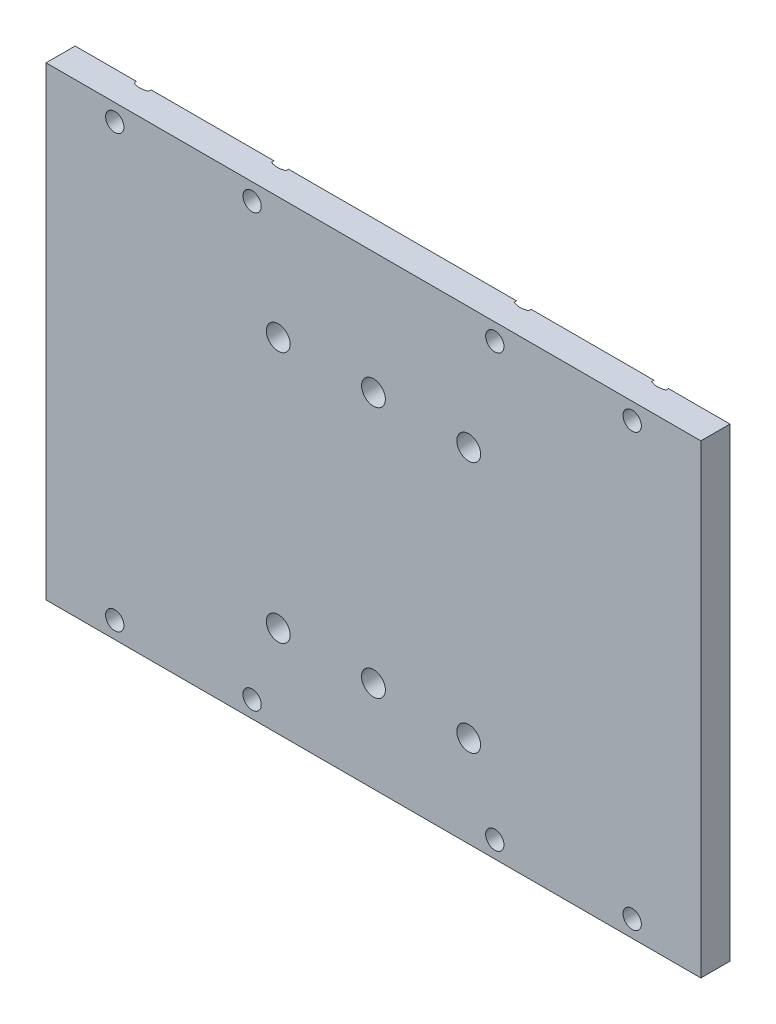
from build123d import *

# Parameters (mm, degrees)
ESBO_O1_W                       = 143.01
ESBO_O1_H                       = 101.6
RESSALTO_EXTRUS_O1_DEPTH        = 6.35
ESBO_O2_R                       = 2
CORTE_EXTRUS_O1_DEPTH           = 13
ESBO_O3_R                       = 2.6
CORTE_EXTRUS_O2_DEPTH           = 7
ESBO_O4_R                       = 4
CORTE_EXTRUS_O3_DEPTH           = 0.55
CROQUIS1_R                      = 4
CORTAR_EXTRUIR1_DEPTH           = 2
CORTAR_EXTRUIR1_DRAFT           = -45
CORTAR_EXTRUIR1_PROFILE_2_DEPTH = 2
CORTAR_EXTRUIR1_PROFILE_2_DRAFT = -45
CORTAR_EXTRUIR1_PROFILE_3_DEPTH = 2
CORTAR_EXTRUIR1_PROFILE_3_DRAFT = -45
CORTAR_EXTRUIR1_PROFILE_4_DEPTH = 2
CORTAR_EXTRUIR1_PROFILE_4_DRAFT = -45
CORTAR_EXTRUIR1_PROFILE_5_DEPTH = 2
CORTAR_EXTRUIR1_PROFILE_5_DRAFT = -45
CORTAR_EXTRUIR1_PROFILE_6_DEPTH = 2
CORTAR_EXTRUIR1_PROFILE_6_DRAFT = -45
CORTAR_EXTRUIR1_PROFILE_7_DEPTH = 2
CORTAR_EXTRUIR1_PROFILE_7_DRAFT = -45
CORTAR_EXTRUIR1_PROFILE_8_DEPTH = 2
CORTAR_EXTRUIR1_PROFILE_8_DRAFT = -45


with BuildPart() as part:
    # Esboço1 → Ressalto-extrusão1 (new body)
    with BuildSketch(Plane.XY):
        Rectangle(ESBO_O1_W, ESBO_O1_H)
    extrude(amount=RESSALTO_EXTRUS_O1_DEPTH)

    # Esboço2 → Corte-extrusão1 (cut)
    with BuildSketch(Plane(origin=(0, 0, 0), x_dir=(-1, 0, 0), z_dir=(0, 0, -1))):
        with Locations((56.505, 47.125)):
            Circle(ESBO_O2_R)
        with Locations((26.505, 47.125)):
            Circle(ESBO_O2_R)
        with Locations((26.505, -47.125)):
            Circle(ESBO_O2_R)
        with Locations((56.505, -47.125)):
            Circle(ESBO_O2_R)
        with Locations((-26.505, 47.125)):
            Circle(ESBO_O2_R)
        with Locations((-56.505, 47.125)):
            Circle(ESBO_O2_R)
        with Locations((-56.505, -47.125)):
            Circle(ESBO_O2_R)
        with Locations((-26.505, -47.125)):
            Circle(ESBO_O2_R)
    extrude(amount=-CORTE_EXTRUS_O1_DEPTH, mode=Mode.SUBTRACT)

    # Esboço3 → Corte-extrusão2 (cut)
    with BuildSketch(Plane.XY.offset(6.35)):
        with Locations((20.8, -30.8)):
            Circle(ESBO_O3_R)
        with Locations((0, -30.8)):
            Circle(ESBO_O3_R)
        with Locations((-20.8, -30.8)):
            Circle(ESBO_O3_R)
        with Locations((-20.8, 24.2)):
            Circle(ESBO_O3_R)
        with Locations((0, 24.2)):
            Circle(ESBO_O3_R)
        with Locations((20.8, 24.2)):
            Circle(ESBO_O3_R)
    extrude(amount=-CORTE_EXTRUS_O2_DEPTH, mode=Mode.SUBTRACT)

    # Esboço4 → Corte-extrusão3 (cut)
    with BuildSketch(Plane(origin=(0, 0, 0), x_dir=(-1, 0, 0), z_dir=(0, 0, -1))):
        with Locations((-26.505, 47.125)):
            Circle(ESBO_O4_R)
        with Locations((-56.505, 47.125)):
            Circle(ESBO_O4_R)
        with Locations((-56.505, -47.125)):
            Circle(ESBO_O4_R)
        with Locations((-26.505, -47.125)):
            Circle(ESBO_O4_R)
        with Locations((26.505, -47.125)):
            Circle(ESBO_O4_R)
        with Locations((56.505, 47.125)):
            Circle(ESBO_O4_R)
        with Locations((26.505, 47.125)):
            Circle(ESBO_O4_R)
        with Locations((56.505, -47.125)):
            Circle(ESBO_O4_R)
    extrude(amount=-CORTE_EXTRUS_O3_DEPTH, mode=Mode.SUBTRACT)


with BuildPart() as cortar_extruir1_tool:
    # Croquis1 → Cortar-Extruir1 (with draft: the straight prism first)
    with BuildSketch(Plane(origin=(0, 0, 0.55), x_dir=(-1, 0, 0), z_dir=(0, 0, -1))):
        with Locations((56.505, 47.125)):
            Circle(CROQUIS1_R)
    extrude(amount=-CORTAR_EXTRUIR1_DEPTH)
    # Cortar-Extruir1: the draft: its side faces are tilted about the plane it starts from
    cortar_extruir1_sides = [cortar_extruir1_tool.faces().sort_by_distance(p)[0] for p in [
        (-52.505, 47.125, 1.55),
    ]]
    draft(cortar_extruir1_sides, Plane(origin=(0, 0, 0.55), x_dir=(-1, 0, 0), z_dir=(0, 0, -1)), CORTAR_EXTRUIR1_DRAFT)


with BuildPart() as part_1:
    add(part.part)

    # Cortar-Extruir1: cut by cortar_extruir1_tool
    add(cortar_extruir1_tool.part, mode=Mode.SUBTRACT)


with BuildPart() as cortar_extruir1_profile_2_tool:
    # Croquis1 → Cortar-Extruir1 profile 2 (with draft: the straight prism first)
    with BuildSketch(Plane(origin=(0, 0, 0.55), x_dir=(-1, 0, 0), z_dir=(0, 0, -1))):
        with Locations((26.505, 47.125)):
            Circle(CROQUIS1_R)
    extrude(amount=-CORTAR_EXTRUIR1_PROFILE_2_DEPTH)
    # Cortar-Extruir1 profile 2: the draft: its side faces are tilted about the plane it starts from
    cortar_extruir1_profile_2_sides = [cortar_extruir1_profile_2_tool.faces().sort_by_distance(p)[0] for p in [
        (-22.505, 47.125, 1.55),
    ]]
    draft(cortar_extruir1_profile_2_sides, Plane(origin=(0, 0, 0.55), x_dir=(-1, 0, 0), z_dir=(0, 0, -1)), CORTAR_EXTRUIR1_PROFILE_2_DRAFT)


with BuildPart() as part_2:
    add(part_1.part)

    # Cortar-Extruir1 profile 2: cut by cortar_extruir1_profile_2_tool
    add(cortar_extruir1_profile_2_tool.part, mode=Mode.SUBTRACT)


with BuildPart() as cortar_extruir1_profile_3_tool:
    # Croquis1 → Cortar-Extruir1 profile 3 (with draft: the straight prism first)
    with BuildSketch(Plane(origin=(0, 0, 0.55), x_dir=(-1, 0, 0), z_dir=(0, 0, -1))):
        with Locations((-26.505, 47.125)):
            Circle(CROQUIS1_R)
    extrude(amount=-CORTAR_EXTRUIR1_PROFILE_3_DEPTH)
    # Cortar-Extruir1 profile 3: the draft: its side faces are tilted about the plane it starts from
    cortar_extruir1_profile_3_sides = [cortar_extruir1_profile_3_tool.faces().sort_by_distance(p)[0] for p in [
        (30.505, 47.125, 1.55),
    ]]
    draft(cortar_extruir1_profile_3_sides, Plane(origin=(0, 0, 0.55), x_dir=(-1, 0, 0), z_dir=(0, 0, -1)), CORTAR_EXTRUIR1_PROFILE_3_DRAFT)


with BuildPart() as part_3:
    add(part_2.part)

    # Cortar-Extruir1 profile 3: cut by cortar_extruir1_profile_3_tool
    add(cortar_extruir1_profile_3_tool.part, mode=Mode.SUBTRACT)


with BuildPart() as cortar_extruir1_profile_4_tool:
    # Croquis1 → Cortar-Extruir1 profile 4 (with draft: the straight prism first)
    with BuildSketch(Plane(origin=(0, 0, 0.55), x_dir=(-1, 0, 0), z_dir=(0, 0, -1))):
        with Locations((-56.505, 47.125)):
            Circle(CROQUIS1_R)
    extrude(amount=-CORTAR_EXTRUIR1_PROFILE_4_DEPTH)
    # Cortar-Extruir1 profile 4: the draft: its side faces are tilted about the plane it starts from
    cortar_extruir1_profile_4_sides = [cortar_extruir1_profile_4_tool.faces().sort_by_distance(p)[0] for p in [
        (60.505, 47.125, 1.55),
    ]]
    draft(cortar_extruir1_profile_4_sides, Plane(origin=(0, 0, 0.55), x_dir=(-1, 0, 0), z_dir=(0, 0, -1)), CORTAR_EXTRUIR1_PROFILE_4_DRAFT)


with BuildPart() as part_4:
    add(part_3.part)

    # Cortar-Extruir1 profile 4: cut by cortar_extruir1_profile_4_tool
    add(cortar_extruir1_profile_4_tool.part, mode=Mode.SUBTRACT)


with BuildPart() as cortar_extruir1_profile_5_tool:
    # Croquis1 → Cortar-Extruir1 profile 5 (with draft: the straight prism first)
    with BuildSketch(Plane(origin=(0, 0, 0.55), x_dir=(-1, 0, 0), z_dir=(0, 0, -1))):
        with Locations((-56.505, -47.125)):
            Circle(CROQUIS1_R)
    extrude(amount=-CORTAR_EXTRUIR1_PROFILE_5_DEPTH)
    # Cortar-Extruir1 profile 5: the draft: its side faces are tilted about the plane it starts from
    cortar_extruir1_profile_5_sides = [cortar_extruir1_profile_5_tool.faces().sort_by_distance(p)[0] for p in [
        (60.505, -47.125, 1.55),
    ]]
    draft(cortar_extruir1_profile_5_sides, Plane(origin=(0, 0, 0.55), x_dir=(-1, 0, 0), z_dir=(0, 0, -1)), CORTAR_EXTRUIR1_PROFILE_5_DRAFT)


with BuildPart() as part_5:
    add(part_4.part)

    # Cortar-Extruir1 profile 5: cut by cortar_extruir1_profile_5_tool
    add(cortar_extruir1_profile_5_tool.part, mode=Mode.SUBTRACT)


with BuildPart() as cortar_extruir1_profile_6_tool:
    # Croquis1 → Cortar-Extruir1 profile 6 (with draft: the straight prism first)
    with BuildSketch(Plane(origin=(0, 0, 0.55), x_dir=(-1, 0, 0), z_dir=(0, 0, -1))):
        with Locations((-26.505, -47.125)):
            Circle(CROQUIS1_R)
    extrude(amount=-CORTAR_EXTRUIR1_PROFILE_6_DEPTH)
    # Cortar-Extruir1 profile 6: the draft: its side faces are tilted about the plane it starts from
    cortar_extruir1_profile_6_sides = [cortar_extruir1_profile_6_tool.faces().sort_by_distance(p)[0] for p in [
        (30.505, -47.125, 1.55),
    ]]
    draft(cortar_extruir1_profile_6_sides, Plane(origin=(0, 0, 0.55), x_dir=(-1, 0, 0), z_dir=(0, 0, -1)), CORTAR_EXTRUIR1_PROFILE_6_DRAFT)


with BuildPart() as part_6:
    add(part_5.part)

    # Cortar-Extruir1 profile 6: cut by cortar_extruir1_profile_6_tool
    add(cortar_extruir1_profile_6_tool.part, mode=Mode.SUBTRACT)


with BuildPart() as cortar_extruir1_profile_7_tool:
    # Croquis1 → Cortar-Extruir1 profile 7 (with draft: the straight prism first)
    with BuildSketch(Plane(origin=(0, 0, 0.55), x_dir=(-1, 0, 0), z_dir=(0, 0, -1))):
        with Locations((26.505, -47.125)):
            Circle(CROQUIS1_R)
    extrude(amount=-CORTAR_EXTRUIR1_PROFILE_7_DEPTH)
    # Cortar-Extruir1 profile 7: the draft: its side faces are tilted about the plane it starts from
    cortar_extruir1_profile_7_sides = [cortar_extruir1_profile_7_tool.faces().sort_by_distance(p)[0] for p in [
        (-22.505, -47.125, 1.55),
    ]]
    draft(cortar_extruir1_profile_7_sides, Plane(origin=(0, 0, 0.55), x_dir=(-1, 0, 0), z_dir=(0, 0, -1)), CORTAR_EXTRUIR1_PROFILE_7_DRAFT)


with BuildPart() as part_7:
    add(part_6.part)

    # Cortar-Extruir1 profile 7: cut by cortar_extruir1_profile_7_tool
    add(cortar_extruir1_profile_7_tool.part, mode=Mode.SUBTRACT)


with BuildPart() as cortar_extruir1_profile_8_tool:
    # Croquis1 → Cortar-Extruir1 profile 8 (with draft: the straight prism first)
    with BuildSketch(Plane(origin=(0, 0, 0.55), x_dir=(-1, 0, 0), z_dir=(0, 0, -1))):
        with Locations((56.505, -47.125)):
            Circle(CROQUIS1_R)
    extrude(amount=-CORTAR_EXTRUIR1_PROFILE_8_DEPTH)
    # Cortar-Extruir1 profile 8: the draft: its side faces are tilted about the plane it starts from
    cortar_extruir1_profile_8_sides = [cortar_extruir1_profile_8_tool.faces().sort_by_distance(p)[0] for p in [
        (-52.505, -47.125, 1.55),
    ]]
    draft(cortar_extruir1_profile_8_sides, Plane(origin=(0, 0, 0.55), x_dir=(-1, 0, 0), z_dir=(0, 0, -1)), CORTAR_EXTRUIR1_PROFILE_8_DRAFT)


with BuildPart() as part_8:
    add(part_7.part)

    # Cortar-Extruir1 profile 8: cut by cortar_extruir1_profile_8_tool
    add(cortar_extruir1_profile_8_tool.part, mode=Mode.SUBTRACT)


solid = part_8.part
